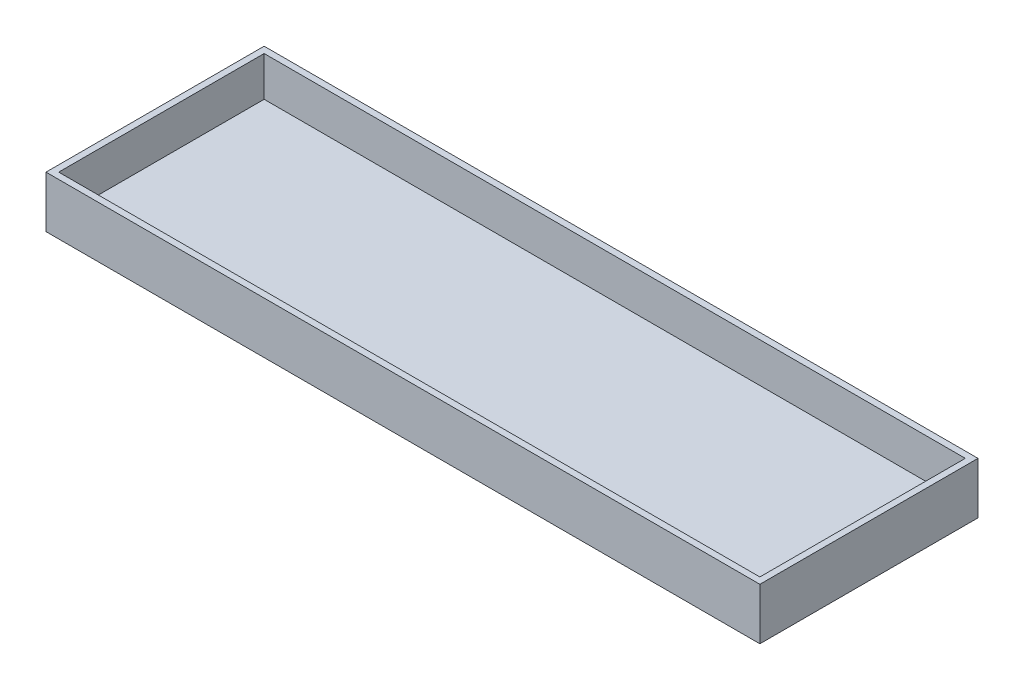
from build123d import *

# Parameters (mm, degrees)
SKETCH1_W           = 180
SKETCH1_H           = 55
BOSS_EXTRUDE1_DEPTH = 3
SKETCH2_W           = 180
SKETCH2_H           = 55
SKETCH2_W_2         = 176.8
SKETCH2_H_2         = 51.8
BOSS_EXTRUDE2_DEPTH = 10


with BuildPart() as part:
    # Sketch1 → Boss-Extrude1 (new body)
    with BuildSketch(Plane(origin=(0, 0, 0), x_dir=(1, 0, 0), z_dir=(0, 1, 0))):
        Rectangle(SKETCH1_W, SKETCH1_H)
    extrude(amount=BOSS_EXTRUDE1_DEPTH)

    # Sketch2 → Boss-Extrude2 (add)
    with BuildSketch(Plane(origin=(0, 3, 0), x_dir=(1, 0, 0), z_dir=(0, 1, 0))):
        Rectangle(SKETCH2_W, SKETCH2_H)
        Rectangle(SKETCH2_W_2, SKETCH2_H_2, mode=Mode.SUBTRACT)
    extrude(amount=BOSS_EXTRUDE2_DEPTH)


solid = part.part
